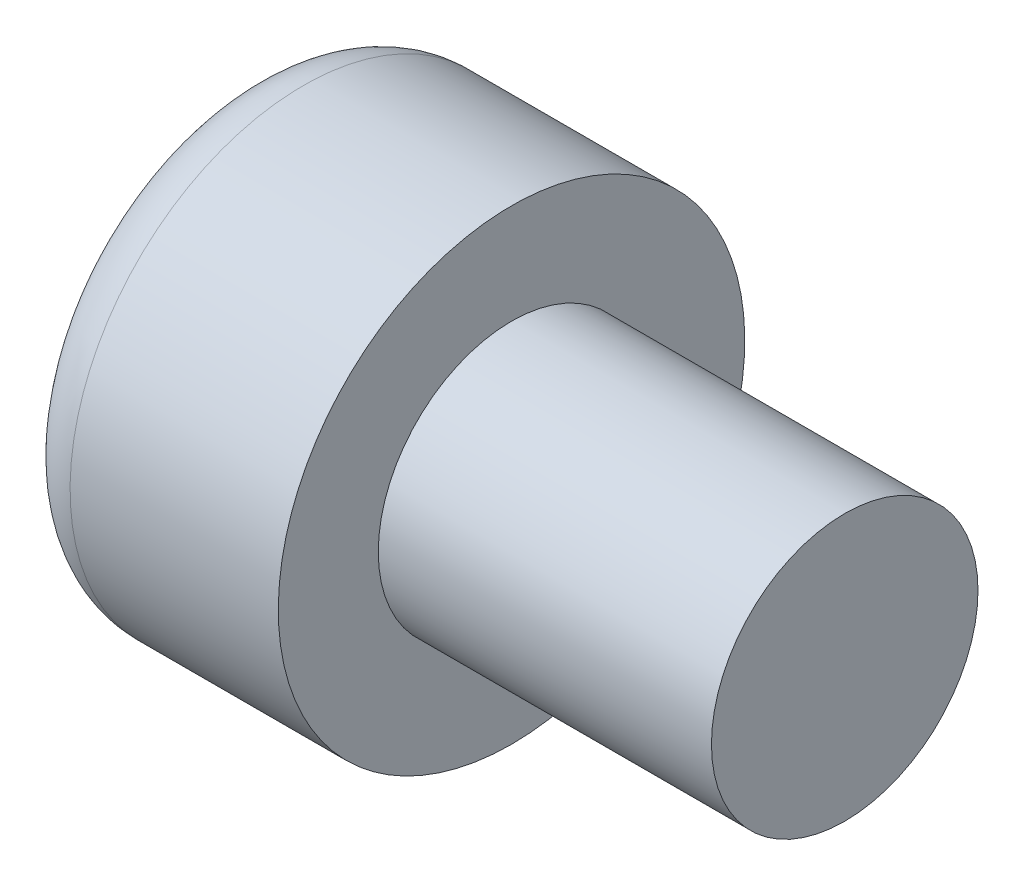
from build123d import *

# Parameters (mm, degrees)
CUT_EXTRUDE1_DEPTH = 2


with BuildPart() as part:
    # Sketch1 → Revolve1 (revolve)
    with BuildSketch(Plane.XY, mode=Mode.PRIVATE) as revolve1_sk:
        with BuildLine():
            Line((0, 0), (0, 2.625))
            ThreePointArc((0, 2.625), (0.256281566, 3.243718434), (0.875, 3.5))
            Line((0.875, 3.5), (4, 3.5))
            Line((4, 3.5), (4, 2))
            Line((4, 2), (9, 2))
            Line((9, 2), (9, 0))
            Line((9, 0), (0, 0))
        make_face()
    revolve(revolve1_sk.sketch.rotate(Axis((0, 0, 0), (1, 0, 0)), 180), axis=Axis((0, 0, 0), (1, 0, 0)))

    # Sketch2 → Cut-Extrude1 (cut)
    with BuildSketch(Plane.ZY):
        Polygon((0, 1.732050808), (-1.5, 0.866025404), (-1.5, -0.866025404), (0, -1.732050808), (1.5, -0.866025404), (1.5, 0.866025404), align=None)
    extrude(amount=-CUT_EXTRUDE1_DEPTH, mode=Mode.SUBTRACT)


solid = part.part
